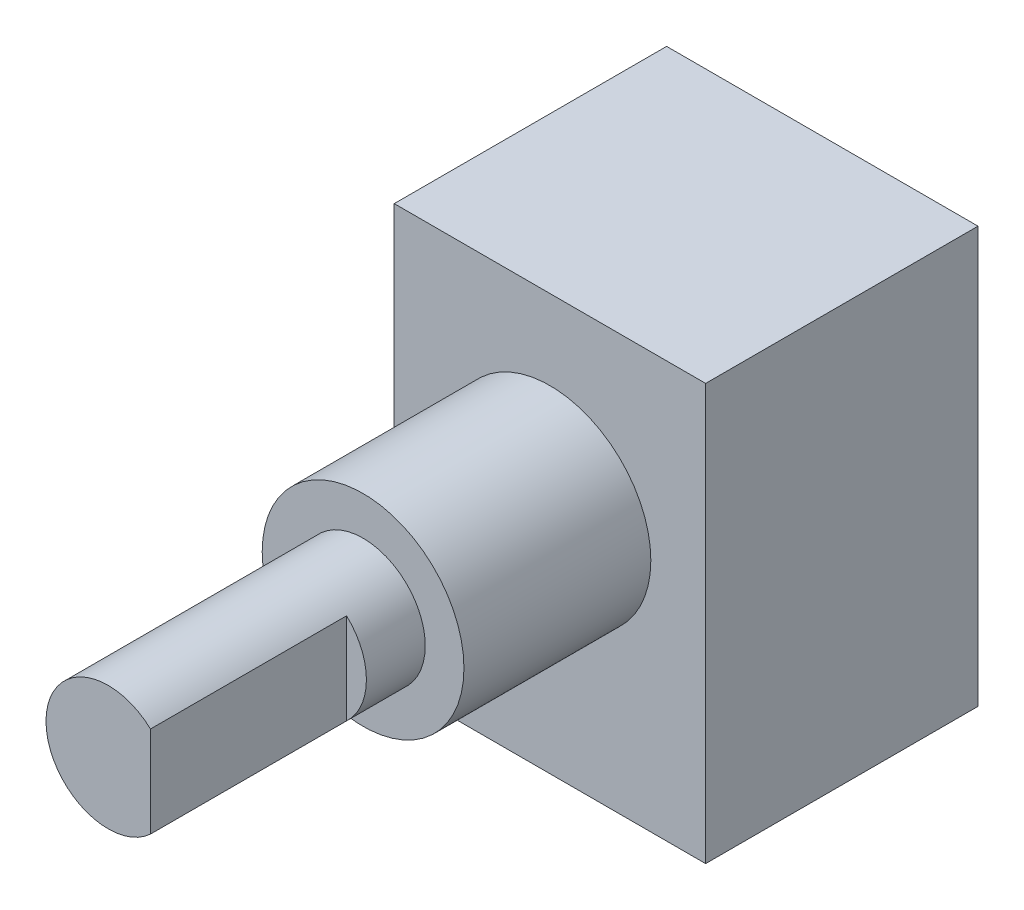
from build123d import *

# Parameters (mm, degrees)
SKETCH2_W           = 15.88
SKETCH2_H           = 21.21
BOSS_EXTRUDE1_DEPTH = 13.89
SKETCH3_R           = 5.145
BOSS_EXTRUDE2_DEPTH = 9.53
SKETCH4_R           = 3.17
BOSS_EXTRUDE3_DEPTH = 13
CUT_EXTRUDE1_DEPTH  = 10


with BuildPart() as part:
    # Sketch2 → Boss-Extrude1 (new body)
    with BuildSketch(Plane.XY):
        with Locations((7.94, 10.605)):
            Rectangle(SKETCH2_W, SKETCH2_H)
    extrude(amount=BOSS_EXTRUDE1_DEPTH)

    # Sketch3 → Boss-Extrude2 (add)
    with BuildSketch(Plane.XY.offset(13.89)):
        with Locations((7.94, 12)):
            Circle(SKETCH3_R)
    extrude(amount=BOSS_EXTRUDE2_DEPTH)

    # Sketch4 → Boss-Extrude3 (add)
    with BuildSketch(Plane.XY.offset(23.42)):
        with Locations(Location((7.94, 12, 0), (0, 0, 180))):
            Circle(SKETCH4_R)
    extrude(amount=BOSS_EXTRUDE3_DEPTH)

    # Sketch5 → Cut-Extrude1 (cut)
    with BuildSketch(Plane.XY.offset(36.42)):
        with BuildLine():
            Line((10.099, 14.327948453), (10.099, 9.672051547))
            ThreePointArc((10.099, 9.672051547), (11.115, 12), (10.099, 14.327948453))
        make_face()
    extrude(amount=-CUT_EXTRUDE1_DEPTH, mode=Mode.SUBTRACT)


solid = part.part
